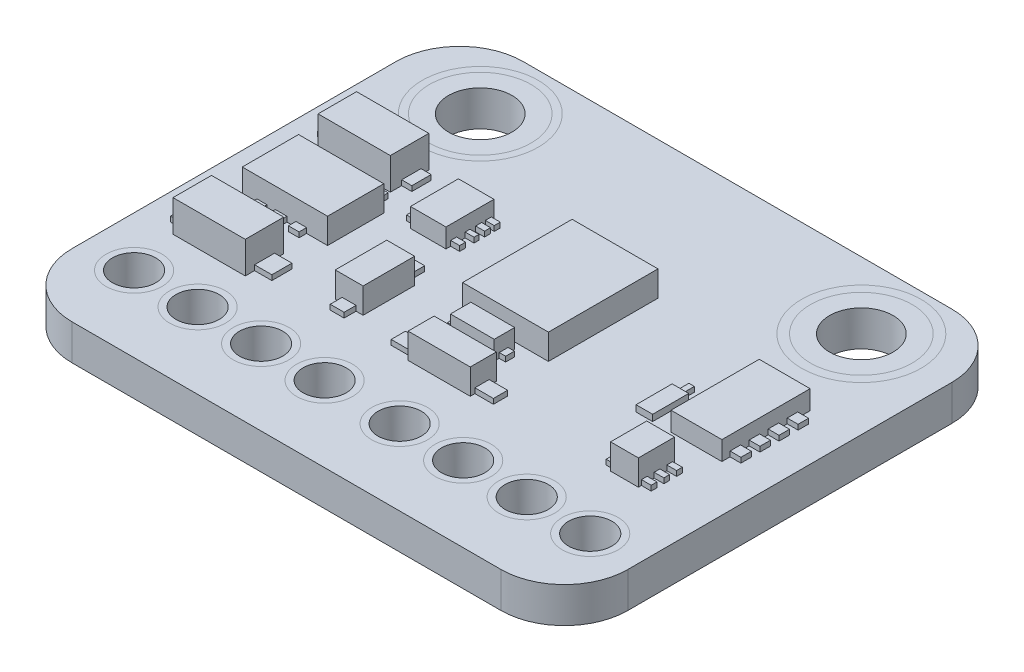
from build123d import *

# Parameters (mm, degrees)
BOSS_EXTRUDE1_DEPTH = 1.4224
SKETCH2_R           = 1.27
SKETCH2_R_2         = 0.865438157
CUT_EXTRUDE1_DEPTH  = 6.5024
SKETCH4_W           = 2.888700977
SKETCH4_H           = 1.539061996
BOSS_EXTRUDE2_DEPTH = 1.27
SKETCH4_3_W         = 3.409614268
SKETCH4_3_H         = 2.249398302
SKETCH4_3_W_2       = 1.112860212
SKETCH4_3_H_2       = 2.059975287
SKETCH4_3_W_3       = 2.486177071
SKETCH4_3_H_3       = 1.041826582
SKETCH4_3_W_4       = 3.433292144
SKETCH4_3_H_4       = 4.380407219
SKETCH4_3_H_5       = 1.444350489
BOSS_EXTRUDE3_DEPTH = 1.016
SKETCH4_4_W         = 1.420672612
SKETCH4_4_H         = 1.917908026
SKETCH4_4_W_2       = 1.752162888
SKETCH4_4_H_2       = 0.816886752
SKETCH4_4_W_3       = 2.03629741
SKETCH4_4_H_3       = 3.528003652
BOSS_EXTRUDE4_DEPTH = 0.762
SKETCH4_5_W         = 0.662980552
SKETCH4_5_H         = 1.444350488
BOSS_EXTRUDE5_DEPTH = 0.254
SKETCH5_W           = 2.73481784
SKETCH5_H           = 0.419699768
SKETCH5_W_2         = 1.80064739
SKETCH5_H_2         = 0.230157937
SKETCH5_W_3         = 2.328656774
SKETCH5_H_3         = 0.352006257
SKETCH5_W_4         = 4.088688057
SKETCH5_H_4         = 0.568625492
SKETCH5_W_5         = 0.555086789
SKETCH5_H_5         = 3.222211118
SKETCH5_W_6         = 4.061416216
SKETCH5_H_6         = 0.802926588
SKETCH5_W_7         = 0.399701376
SKETCH5_H_7         = 0.857823106
SKETCH5_W_8         = 0.466318272
SKETCH5_W_9         = 0.426348134
SKETCH5_W_10        = 0.319761101
SKETCH5_H_8         = 1.105840473
SKETCH5_W_11        = 3.775576257
SKETCH5_H_9         = 0.772755993
SKETCH5_W_12        = 2.123299621
SKETCH5_H_10        = 0.239820825
SKETCH5_H_11        = 0.240852705
SKETCH5_H_12        = 0.194234201
SKETCH5_H_13        = 0.236221561
SKETCH5_W_13        = 0.218524679
SKETCH5_H_14        = 0.92045014
BOSS_EXTRUDE6_DEPTH = 0.2032


with BuildPart() as part:
    # Sketch1 → Boss-Extrude1 (new body)
    with BuildSketch(Plane(origin=(0, 0, 0), x_dir=(1, 0, 0), z_dir=(0, 1, 0))):
        with BuildLine():
            Line((8.5725, -9.017), (-8.5725, -9.017))
            ThreePointArc((-8.5725, -9.017), (-10.368551224, -8.273051224), (-11.1125, -6.477))
            Line((-11.1125, -6.477), (-11.1125, 6.477))
            ThreePointArc((-11.1125, 6.477), (-10.368551224, 8.273051224), (-8.5725, 9.017))
            Line((-8.5725, 9.017), (8.5725, 9.017))
            ThreePointArc((8.5725, 9.017), (10.368551224, 8.273051224), (11.1125, 6.477))
            Line((11.1125, 6.477), (11.1125, -6.477))
            ThreePointArc((11.1125, -6.477), (10.368551224, -8.273051224), (8.5725, -9.017))
        make_face()
    extrude(amount=BOSS_EXTRUDE1_DEPTH)

    # Sketch2 → Cut-Extrude1 (cut)
    with BuildSketch(Plane(origin=(0, 1.4224, 0), x_dir=(1, 0, 0), z_dir=(0, 1, 0))):
        with Locations((-7.62, 6.35)):
            Circle(SKETCH2_R)
        with Locations((-1.500438157, -5.992561843)):
            Circle(SKETCH2_R_2)
        with Locations((-4.040438157, -5.992561843)):
            Circle(SKETCH2_R_2)
        with Locations((-6.580438157, -5.992561843)):
            Circle(SKETCH2_R_2)
        with Locations((-9.120438157, -5.992561843)):
            Circle(SKETCH2_R_2)
        with Locations((9.120438157, -5.992561843)):
            Circle(SKETCH2_R_2)
        with Locations((6.580438157, -5.992561843)):
            Circle(SKETCH2_R_2)
        with Locations((4.040438157, -5.992561843)):
            Circle(SKETCH2_R_2)
        with Locations((1.500438157, -5.992561843)):
            Circle(SKETCH2_R_2)
        with Locations((7.62, 6.35)):
            Circle(SKETCH2_R)
    extrude(amount=-CUT_EXTRUDE1_DEPTH, mode=Mode.SUBTRACT)

    # Sketch4 → Boss-Extrude2 (add)
    with BuildSketch(Plane(origin=(0, 1.4224, 0), x_dir=(1, 0, 0), z_dir=(0, 1, 0))):
        with Locations((-8.14518964, 2.604566455)):
            Rectangle(SKETCH4_W, SKETCH4_H)
        with Locations((-8.14518964, -3.196513376)):
            Rectangle(SKETCH4_W, SKETCH4_H)
    extrude(amount=BOSS_EXTRUDE2_DEPTH)

    # Sketch4<3> → Boss-Extrude3 (add)
    with BuildSketch(Plane(origin=(0, 1.4224, 0), x_dir=(1, 0, 0), z_dir=(0, 1, 0))):
        with Locations((-7.813699364, -0.142067261)):
            Rectangle(SKETCH4_3_W, SKETCH4_3_H)
        with Locations((-3.539842591, -1.941585902)):
            Rectangle(SKETCH4_3_W_2, SKETCH4_3_H_2)
        with Locations((0.722175245, -3.113640807)):
            Rectangle(SKETCH4_3_W_3, SKETCH4_3_H_3)
        with Locations((0.60378586, 1.325961105)):
            Rectangle(SKETCH4_3_W_4, SKETCH4_3_H_4)
        with Locations((7.92024981, -2.699277963)):
            Rectangle(SKETCH4_3_W_2, SKETCH4_3_H_5)
    extrude(amount=BOSS_EXTRUDE3_DEPTH)

    # Sketch4<4> → Boss-Extrude4 (add)
    with BuildSketch(Plane(origin=(0, 1.4224, 0), x_dir=(1, 0, 0), z_dir=(0, 1, 0))):
        with Locations((-4.333051466, 1.941585903)):
            Rectangle(SKETCH4_4_W, SKETCH4_4_H)
        with Locations((0.355168153, -1.533142527)):
            Rectangle(SKETCH4_4_W_2, SKETCH4_4_H_2)
        with Locations((8.239901148, 0.899759321)):
            Rectangle(SKETCH4_4_W_3, SKETCH4_4_H_3)
    extrude(amount=BOSS_EXTRUDE4_DEPTH)

    # Sketch4<5> → Boss-Extrude5 (add)
    with BuildSketch(Plane(origin=(0, 1.4224, 0), x_dir=(1, 0, 0), z_dir=(0, 1, 0))):
        with Locations((6.156247984, -0.142067261)):
            Rectangle(SKETCH4_5_W, SKETCH4_5_H)
    extrude(amount=BOSS_EXTRUDE5_DEPTH)

    # Sketch5 → Boss-Extrude6 (add)
    with BuildSketch(Plane(origin=(0, 1.4224, 0), x_dir=(1, 0, 0), z_dir=(0, 1, 0))):
        with Locations((8.324058017, 0.433864051)):
            Rectangle(SKETCH5_W, SKETCH5_H)
        with Locations((8.324058017, -0.328135949)):
            Rectangle(SKETCH5_W, SKETCH5_H)
        with Locations((8.324058017, 1.195864051)):
            Rectangle(SKETCH5_W, SKETCH5_H)
        with Locations((8.324058017, 1.957864051)):
            Rectangle(SKETCH5_W, SKETCH5_H)
        with Locations((7.965282409, -2.676802109)):
            Rectangle(SKETCH5_W_2, SKETCH5_H_2)
        with Locations((7.965282409, -3.184802109)):
            Rectangle(SKETCH5_W_2, SKETCH5_H_2)
        with Locations((7.965282409, -2.168802109)):
            Rectangle(SKETCH5_W_2, SKETCH5_H_2)
        with Locations((0.32268503, -1.566927199)):
            Rectangle(SKETCH5_W_3, SKETCH5_H_3)
        with Locations((0.661152585, -3.164494055)):
            Rectangle(SKETCH5_W_4, SKETCH5_H_4)
        with Locations((-3.542614442, -1.837701242)):
            Rectangle(SKETCH5_W_5, SKETCH5_H_5)
        with Locations((-8.039228602, -3.193344371)):
            Rectangle(SKETCH5_W_6, SKETCH5_H_6)
        with Locations((-8.732538846, -1.138015645)):
            Rectangle(SKETCH5_W_7, SKETCH5_H_7)
        with Locations((-7.966444542, -1.138015645)):
            Rectangle(SKETCH5_W_8, SKETCH5_H_7)
        with Locations((-7.160380101, -1.138015645)):
            Rectangle(SKETCH5_W_9, SKETCH5_H_7)
        with Locations((-8.892419396, 1.016273514)):
            Rectangle(SKETCH5_W_10, SKETCH5_H_8)
        with Locations((-6.734031967, 1.016273514)):
            Rectangle(SKETCH5_W_9, SKETCH5_H_8)
        with Locations((-8.182148581, 2.675034223)):
            Rectangle(SKETCH5_W_11, SKETCH5_H_9)
        with Locations((-4.326720857, 2.675034223)):
            Rectangle(SKETCH5_W_12, SKETCH5_H_10)
        with Locations((-4.326720857, 2.288140288)):
            Rectangle(SKETCH5_W_12, SKETCH5_H_11)
        with Locations((-4.326720857, 1.845131268)):
            Rectangle(SKETCH5_W_12, SKETCH5_H_12)
        with Locations((-4.326720857, 1.287603155)):
            Rectangle(SKETCH5_W_12, SKETCH5_H_13)
        with Locations((6.197282799, 0.525789097)):
            Rectangle(SKETCH5_W_13, SKETCH5_H_14)
    extrude(amount=BOSS_EXTRUDE6_DEPTH)


solid = part.part
